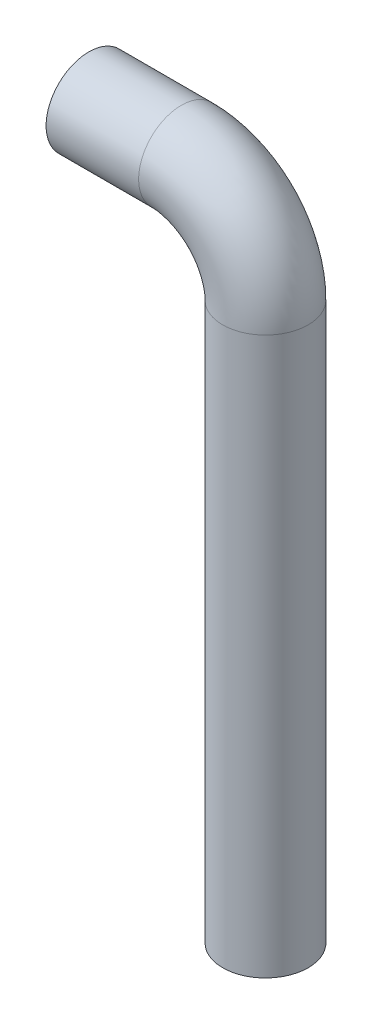
from build123d import *

# Parameters (mm, degrees)
SKETCH2_R   = 50.8
SKETCH2_R_2 = 29.86


with BuildPart() as part:
    # Sweep1: sweep along a path in Sketch1
    with BuildLine(Plane.XY) as sweep1_path:
        Line((0, 0), (110, 0))
        ThreePointArc((110, 0), (180.710678119, -29.289321881), (210, -100))
        Line((210, -100), (210, -762))
    # Sketch2 → Sweep1 (sweep)
    with BuildSketch(Plane(origin=(0, 0, 0), x_dir=(0, 0, -1), z_dir=(1, 0, 0))):
        Circle(SKETCH2_R)
        Circle(SKETCH2_R_2, mode=Mode.SUBTRACT)
    sweep(path=sweep1_path.line)


solid = part.part
